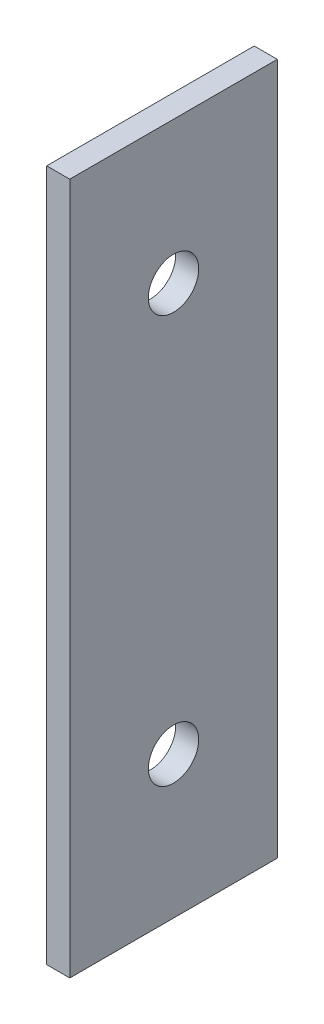
from build123d import *

# Parameters (mm, degrees)
BOSS_EXTRUDE1_DEPTH = 9
SKETCH2_R           = 1.0922
CUT_EXTRUDE1_DEPTH  = 10


with BuildPart() as part:
    # Sketch1 → Boss-Extrude1 (new body)
    with BuildSketch(Plane.XY):
        Polygon((3.129243729, 7.05753004), (2.129243729, 7.05753004), (2.129243729, -22.94246996), (3.129243729, -22.94246996), (3.129243729, -4.94246996), align=None)
    extrude(amount=BOSS_EXTRUDE1_DEPTH)

    # Sketch2 → Cut-Extrude1 (cut)
    with BuildSketch(Plane(origin=(3.129243729, 0, 0), x_dir=(0, 0, -1), z_dir=(1, 0, 0))):
        with Locations(Location((-4.5, 0.89753004, 0), (0, 0, 90))):
            Circle(SKETCH2_R)
        with Locations(Location((-4.5, -16.78246996, 0), (0, 0, 90))):
            Circle(SKETCH2_R)
    extrude(amount=-CUT_EXTRUDE1_DEPTH, mode=Mode.SUBTRACT)


solid = part.part
